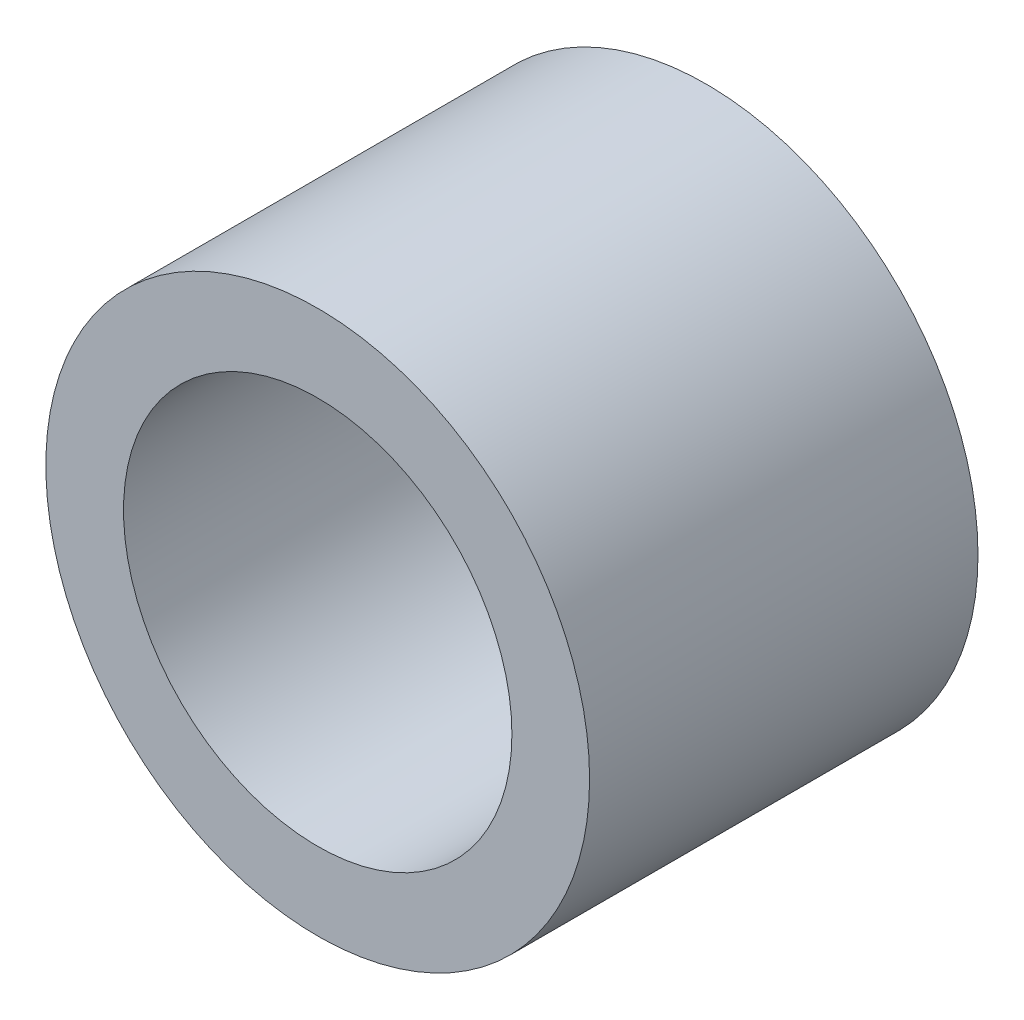
from build123d import *

# Parameters (mm, degrees)
SKETCH_1_R      = 3.5
SKETCH_1_R_2    = 2.5
EXTRUDE_1_DEPTH = 2.5


with BuildPart() as part:
    # 草图1 → 凸台-拉伸1 (new, symmetric)
    with BuildSketch(Plane.XY):
        Circle(SKETCH_1_R)
        Circle(SKETCH_1_R_2, mode=Mode.SUBTRACT)
    extrude(amount=EXTRUDE_1_DEPTH, both=True)


solid = part.part
